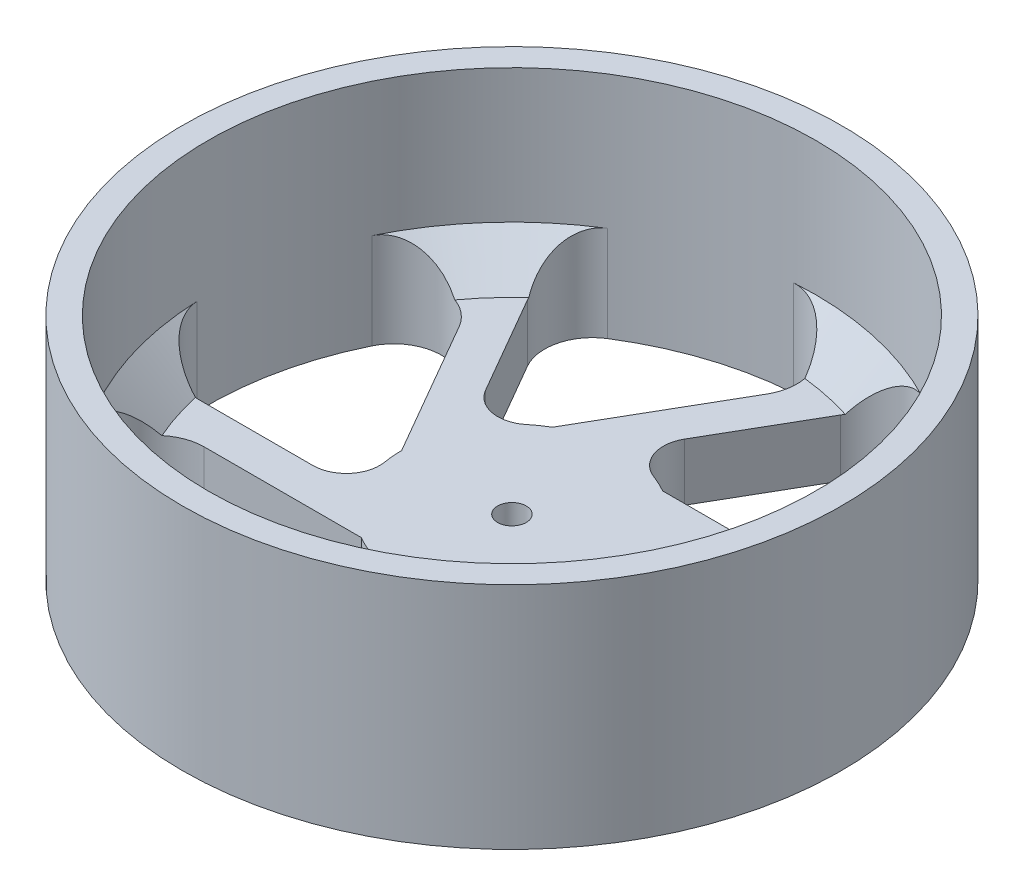
from build123d import *
from build123d.topology import SkipClean

# Parameters (mm, degrees)
SKETCH1_R           = 34.5
BOSS_EXTRUDE1_DEPTH = 24
SKETCH6_R           = 1.5
CUT_EXTRUDE6_DEPTH  = 24
CUT_EXTRUDE7_DEPTH  = 24
CIRPATTERN1_COUNT   = 6


with BuildPart() as part:
    # Sketch1 → Boss-Extrude1 (new body)
    with BuildSketch(Plane(origin=(0, 0, 0), x_dir=(1, 0, 0), z_dir=(0, 1, 0))):
        with Locations(Location((0, 0, 0), (0, 0, 270))):
            Circle(SKETCH1_R)
    extrude(amount=BOSS_EXTRUDE1_DEPTH)

    # Sketch6 → Cut-Extrude6 (cut)
    with BuildSketch(Plane(origin=(0, 0, 0), x_dir=(1, 0, 0), z_dir=(0, 1, 0))):
        with Locations(Location((0, 0, 0), (0, 0, 90))):
            Circle(SKETCH6_R)
    extrude(amount=CUT_EXTRUDE6_DEPTH, mode=Mode.SUBTRACT)

    # Sketch3 → Cut-Extrude7 (cut)
    with BuildSketch(Plane(origin=(0, 0, 0), x_dir=(1, 0, 0), z_dir=(0, 1, 0))):
        with BuildLine():
            ThreePointArc((4.03179755, 10.82025609), (4.919774713, 10.446489846), (5.773502692, 10))
            Line((5.773502692, 10), (22.209007182, 10))
            ThreePointArc((22.209007182, 10), (26.624465103, 12.65399673), (26.352478671, 17.798507463))
            ThreePointArc((26.352478671, 17.798507463), (21.242536942, 23.664205549), (14.861330114, 28.113713153))
            ThreePointArc((14.861330114, 28.113713153), (11.140652369, 28.497958465), (8.19451597, 26.193318003))
            Line((8.19451597, 26.193318003), (2.222782323, 15.849971917))
            ThreePointArc((2.222782323, 15.849971917), (1.960414336, 12.915429114), (4.03179755, 10.82025609))
        make_face()
    cut_extrude7 = extrude(amount=CUT_EXTRUDE7_DEPTH, mode=Mode.SUBTRACT)

    # CirPattern1: Cut-Extrude7 ×6 about axis
    cirpattern1_axis = Axis((0, 0, 0), (0, 1, 0))
    for i in range(1, CIRPATTERN1_COUNT):
        add(cut_extrude7.rotate(cirpattern1_axis, i * 360 / CIRPATTERN1_COUNT), mode=Mode.SUBTRACT)

    # Sketch14 → Revolve1 (revolve)
    with BuildSketch(Plane.XY):
        Polygon((32, 13), (32, 12), (34.5, 12), (34.5, 14), align=None)
    revolve1 = revolve(axis=Axis((0, 24, 0), (0, -1, 0)))

    # Mirror11: Revolve1 across plane
    add(revolve1.mirror(Plane.ZX.offset(12)))

    # Sketch15 → Cut-Revolve5 (revolve, cut)
    with SkipClean():  # the faces are left unmerged after this step: merging them gives an invalid solid
        with BuildSketch(Plane.XY, mode=Mode.PRIVATE) as cut_revolve5_sk:
            Polygon((1.5, 6), (1.5, 0), (0, 0), (0, 6), (0, 24), (31.8, 24), (31.8, 10), (27.8, 6), align=None)
        revolve(cut_revolve5_sk.sketch.rotate(Axis((0, 6, 0), (0, -1, 0)), 270), axis=Axis((0, 6, 0), (0, -1, 0)), mode=Mode.SUBTRACT)


solid = part.part
